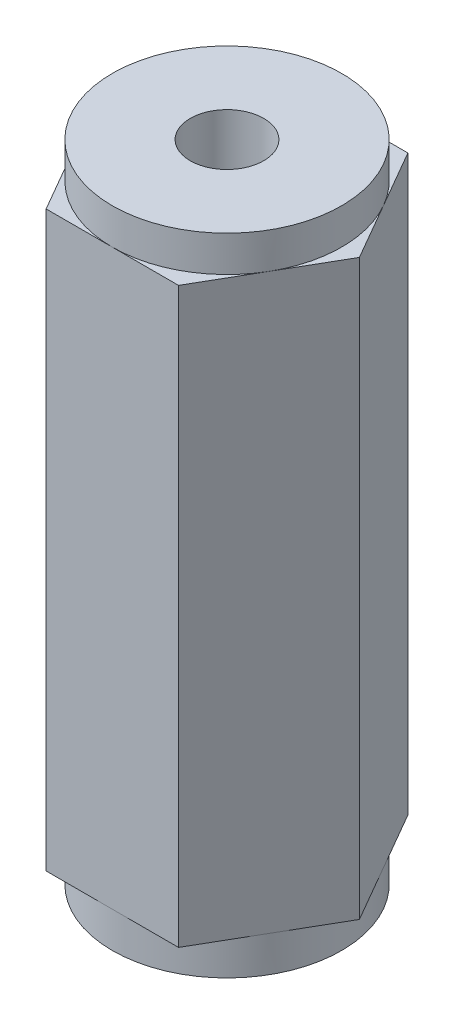
from build123d import *

# Parameters (mm, degrees)
BOSS_EXTRUDE1_DEPTH = 9
SKETCH3_OUTSIDE_W   = 13.486
SKETCH3_OUTSIDE_H   = 12.496
SKETCH3_OUTSIDE_R   = 3.2
CUT_EXTRUDE1_DEPTH  = 1


with BuildPart() as part:
    # Sketch1 → Boss-Extrude1 (new, symmetric)
    with BuildSketch(Plane(origin=(0, 0, 0), x_dir=(1, 0, 0), z_dir=(0, 1, 0))):
        Polygon((3.695041723, 0), (1.847520861, 3.2), (-1.847520861, 3.2), (-3.695041723, 0), (-1.847520861, -3.2), (1.847520861, -3.2), align=None)
    extrude(amount=BOSS_EXTRUDE1_DEPTH, both=True)

    # Sketch3 outside → Cut-Extrude1 (cut)
    with BuildSketch(Plane(origin=(0, 9, 0), x_dir=(1, 0, 0), z_dir=(0, 1, 0))):
        Rectangle(SKETCH3_OUTSIDE_W, SKETCH3_OUTSIDE_H)
        with Locations(Location((0, 0, 0), (0, 0, 270))):
            Circle(SKETCH3_OUTSIDE_R, mode=Mode.SUBTRACT)
    cut_extrude1 = extrude(amount=-CUT_EXTRUDE1_DEPTH, mode=Mode.SUBTRACT)

    # Mirror2: Cut-Extrude1 across plane
    add(cut_extrude1.mirror(Plane.ZX), mode=Mode.SUBTRACT)

    # Sketch2 → M2.5 Tapped Hole1 (revolve, cut)
    with BuildSketch(Plane(origin=(0, 9, 0), x_dir=(0, 0, 1), z_dir=(1, 0, 0))):
        Polygon((0, 0), (0, 6.965882135), (1.025, 6.35), (1.025, 0), align=None)
    m2_5_tapped_hole1 = revolve(axis=Axis((0, 15.35, 0), (0, -1, 0)), mode=Mode.SUBTRACT)

    # Mirror1: M2.5 Tapped Hole1 across plane
    add(m2_5_tapped_hole1.mirror(Plane.ZX), mode=Mode.SUBTRACT)


solid = part.part
